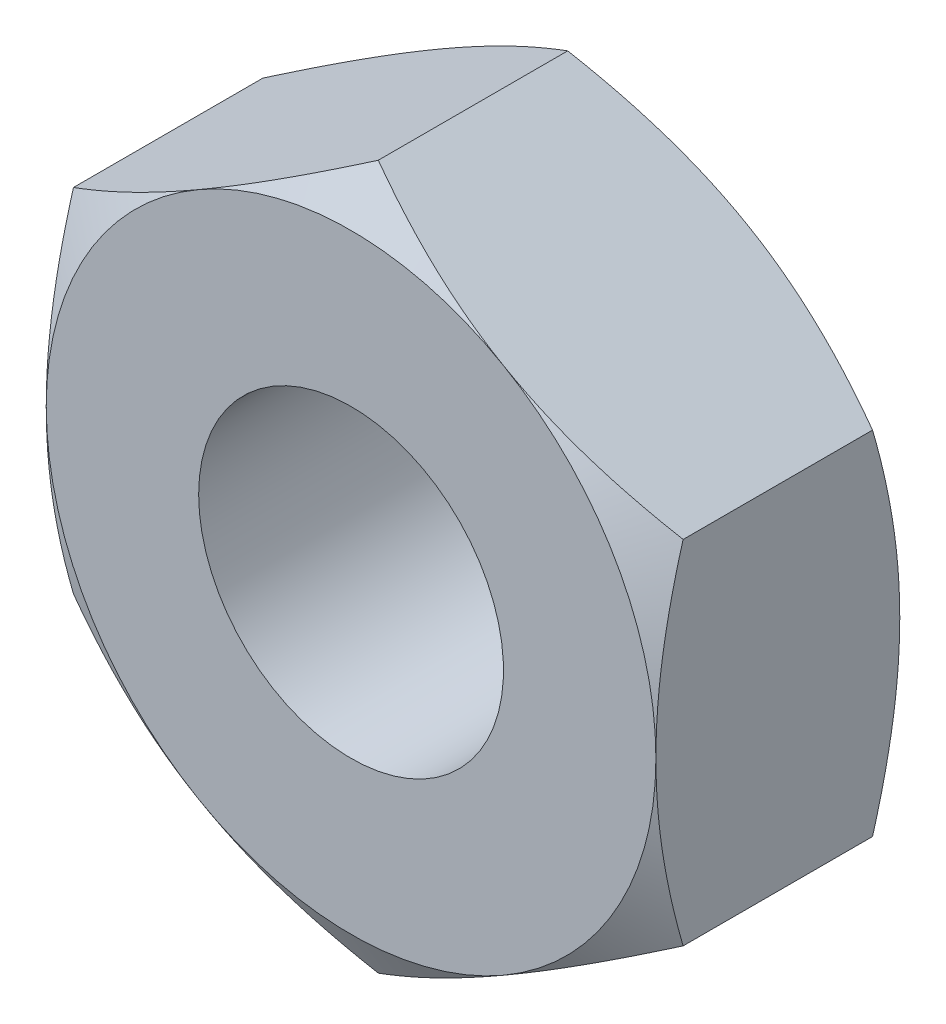
from build123d import *

# Parameters (mm, degrees)
BOSS_EXTRUDE1_DEPTH      = 0.8
BOSS_EXTRUDE1_DEPTH_BACK = 0.8
SKETCH2_R                = 1
SKETCH3_OUTSIDE_W        = 22.674
SKETCH3_OUTSIDE_H        = 23.292
SKETCH3_OUTSIDE_R        = 2
CUT_EXTRUDE1_DEPTH       = 4.448671242
CUT_EXTRUDE1_DRAFT       = -60
MIRROR1_COPY_1_SKETCH_W  = 22.674
MIRROR1_COPY_1_SKETCH_H  = 23.292
MIRROR1_COPY_1_SKETCH_R  = 2
MIRROR1_COPY_1_DEPTH     = 4.448671242
MIRROR1_COPY_1_DRAFT     = -60


with BuildPart() as part:
    # Sketch2 → Boss-Extrude1 (new, two sides: drawn at the far end of the back side and taken through both)
    with BuildSketch(Plane.XY.offset(-BOSS_EXTRUDE1_DEPTH_BACK)):
        Polygon((0, 2.309401077), (-2, 1.154700538), (-2, -1.154700538), (0, -2.309401077), (2, -1.154700538), (2, 1.154700538), align=None)
        with Locations(Location((0, 0, 0), (0, 0, 180))):
            Circle(SKETCH2_R, mode=Mode.SUBTRACT)
    extrude(amount=BOSS_EXTRUDE1_DEPTH + BOSS_EXTRUDE1_DEPTH_BACK)


with BuildPart() as cut_extrude1_tool:
    # Sketch3 outside → Cut-Extrude1 (with draft: the straight prism first)
    with BuildSketch(Plane.XY.offset(0.8)):
        Rectangle(SKETCH3_OUTSIDE_W, SKETCH3_OUTSIDE_H)
        Circle(SKETCH3_OUTSIDE_R, mode=Mode.SUBTRACT)
    extrude(amount=-CUT_EXTRUDE1_DEPTH)
    # Cut-Extrude1: the draft: its side faces are tilted about the plane it starts from
    cut_extrude1_sides = [cut_extrude1_tool.faces().sort_by_distance(p)[0] for p in [
        (0, -11.646, -1.424335621),
        (11.337, 0, -1.424335621),
        (0, 11.646, -1.424335621),
        (-11.337, 0, -1.424335621),
        (-2, 0, -1.424335621),
    ]]
    draft(cut_extrude1_sides, Plane.XY.offset(0.8), CUT_EXTRUDE1_DRAFT)


with BuildPart() as part_1:
    add(part.part)

    # Cut-Extrude1: cut by cut_extrude1_tool
    add(cut_extrude1_tool.part, mode=Mode.SUBTRACT)


with BuildPart() as mirror1_copy_1_tool:
    # Mirror1 copy 1 sketch → Mirror1 copy 1 (with draft: the straight prism first)
    with BuildSketch(Plane(origin=(0, 0, -0.8), x_dir=(1, 0, 0), z_dir=(0, 0, -1))):
        Rectangle(MIRROR1_COPY_1_SKETCH_W, MIRROR1_COPY_1_SKETCH_H)
        Circle(MIRROR1_COPY_1_SKETCH_R, mode=Mode.SUBTRACT)
    extrude(amount=-MIRROR1_COPY_1_DEPTH)
    # Mirror1 copy 1: the draft: its side faces are tilted about the plane it starts from
    mirror1_copy_1_sides = [mirror1_copy_1_tool.faces().sort_by_distance(p)[0] for p in [
        (0, -11.646, 1.424335621),
        (11.337, 0, 1.424335621),
        (0, 11.646, 1.424335621),
        (-11.337, 0, 1.424335621),
        (-2, 0, 1.424335621),
    ]]
    draft(mirror1_copy_1_sides, Plane(origin=(0, 0, -0.8), x_dir=(1, 0, 0), z_dir=(0, 0, -1)), MIRROR1_COPY_1_DRAFT)


with BuildPart() as part_2:
    add(part_1.part)

    # Mirror1 copy 1: cut by mirror1_copy_1_tool
    add(mirror1_copy_1_tool.part, mode=Mode.SUBTRACT)


solid = part_2.part
